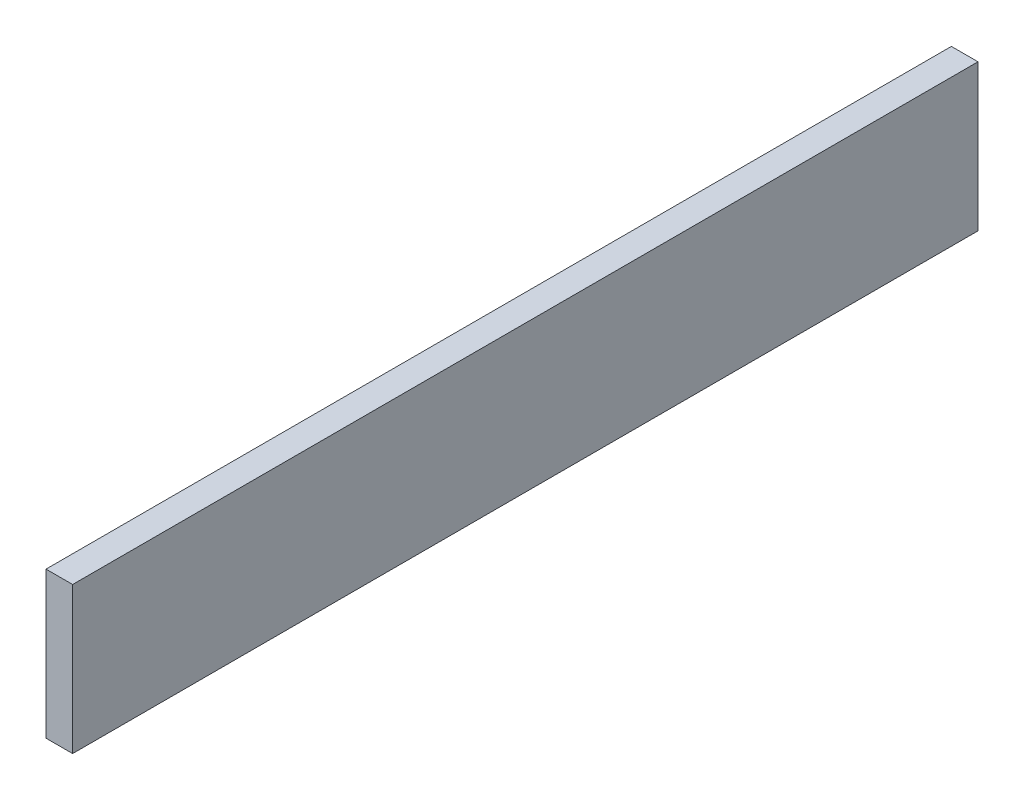
from build123d import *

# Parameters (mm, degrees)
SKETCH1_W           = 431.8
SKETCH1_H           = 69.85
BOSS_EXTRUDE1_DEPTH = 12.7


with BuildPart() as part:
    # Sketch1 → Boss-Extrude1 (new body)
    with BuildSketch(Plane(origin=(0, 0, 0), x_dir=(0, 0, -1), z_dir=(1, 0, 0))):
        Rectangle(SKETCH1_W, SKETCH1_H)
    extrude(amount=BOSS_EXTRUDE1_DEPTH)


solid = part.part
